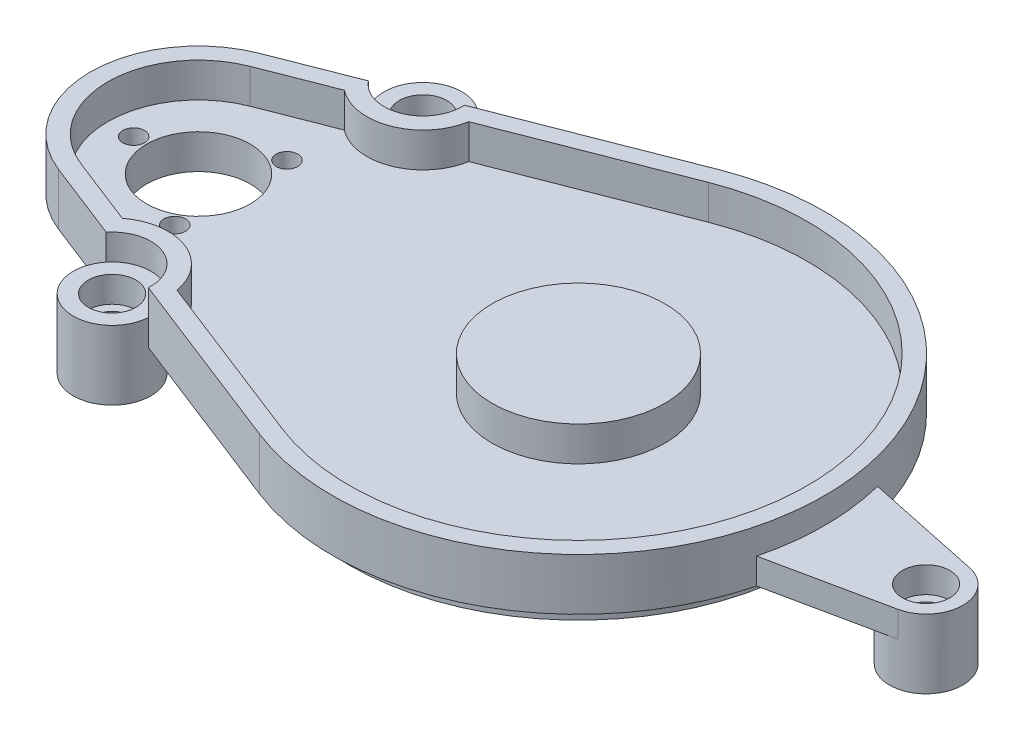
from build123d import *

# Parameters (mm, degrees)
BOSS_EXTRUDE1_DEPTH   = 6
SHELL1_T              = -2
SKETCH2_R             = 2.75
BOSS_EXTRUDE2_DEPTH   = 3
SKETCH2_R_2           = 4.5
BOSS_EXTRUDE2_2_DEPTH = 3
BOSS_EXTRUDE2_3_DEPTH = 3
BOSS_EXTRUDE3_START   = 5
SKETCH3_R             = 4.5
SKETCH3_R_2           = 4.25
BOSS_EXTRUDE3_DEPTH   = 5
SKETCH4_R             = 3.25
CUT_EXTRUDE1_DEPTH    = 2
SKETCH5_R             = 1.75
CUT_EXTRUDE2_DEPTH    = 73.907475611
BOSS_EXTRUDE5_START   = 2
SKETCH7_R             = 11
BOSS_EXTRUDE5_DEPTH   = 2
SKETCH6_R             = 1.25
SKETCH6_R_2           = 6
CUT_EXTRUDE4_DEPTH    = 73.687688091
SKETCH9_R             = 10
BOSS_EXTRUDE6_DEPTH   = 4


with BuildPart() as part:
    # Sketch1 → Boss-Extrude1 (new body)
    with BuildSketch(Plane(origin=(0, 0, 0), x_dir=(1, 0, 0), z_dir=(0, 1, 0))):
        with BuildLine():
            Line((-17.502255184, 15.174365801), (-26.545454545, 11.644262234))
            ThreePointArc((-26.545454545, 11.644262234), (-34.5, 0), (-26.545454545, -11.644262234))
            Line((-26.545454545, -11.644262234), (-17.502255184, -15.174365801))
            ThreePointArc((-17.502255184, -15.174365801), (-12.363636364, -13.808065596), (-9.50963812, -18.294364031))
            Line((-9.50963812, -18.294364031), (11.636363636, -26.548917894))
            ThreePointArc((11.636363636, -26.548917894), (50.5, 0), (11.636363636, 26.548917894))
            Line((11.636363636, 26.548917894), (-9.50963812, 18.294364031))
            ThreePointArc((-9.50963812, 18.294364031), (-12.363636364, 13.808065596), (-17.502255184, 15.174365801))
        make_face()
    extrude(amount=BOSS_EXTRUDE1_DEPTH)

    # Shell1
    shell1_openings = [part.faces().sort_by_distance(p)[0] for p in [
        (12.478104295, 6, 0),
    ]]
    offset(amount=SHELL1_T, openings=shell1_openings, kind=Kind.INTERSECTION)



with BuildPart() as body_2:
    # Sketch2 → Boss-Extrude2 (new body)
    with BuildSketch(Plane.XZ):
        with BuildLine():
            Line((49.626979567, -7), (63.125355805, -4.158876316))
            ThreePointArc((63.125355805, -4.158876316), (66.5, 0), (63.125355805, 4.158876316))
            Line((63.125355805, 4.158876316), (49.626979567, 7))
            ThreePointArc((49.626979567, 7), (50.5, 0), (49.626979567, -7))
        make_face()
        with Locations(Location((62.25, 0, 0), (0, 0, 270))):
            Circle(SKETCH2_R, mode=Mode.SUBTRACT)
    extrude(amount=-BOSS_EXTRUDE2_DEPTH)


with BuildPart() as body_3:
    # Sketch2 → Boss-Extrude2 2 (new body)
    with BuildSketch(Plane.XZ):
        with Locations(Location((-14, -18, 0), (0, 0, 270))):
            Circle(SKETCH2_R_2)
        with Locations(Location((-14, -18, 0), (0, 0, 270))):
            Circle(SKETCH2_R, mode=Mode.SUBTRACT)
    extrude(amount=-BOSS_EXTRUDE2_2_DEPTH)


with BuildPart() as body_4:
    # Sketch2 → Boss-Extrude2 3 (new body)
    with BuildSketch(Plane.XZ):
        with Locations(Location((-14, 18, 0), (0, 0, 90))):
            Circle(SKETCH2_R_2)
        with Locations(Location((-14, 18, 0), (0, 0, 90))):
            Circle(SKETCH2_R, mode=Mode.SUBTRACT)
    extrude(amount=-BOSS_EXTRUDE2_3_DEPTH)


with BuildPart() as part_1:
    add(part.part)

    add(body_2.part)  # Boss-Extrude3 merges body 2

    add(body_3.part)  # Boss-Extrude3 merges body 3

    add(body_4.part)  # Boss-Extrude3 merges body 4
    # Sketch3 → Boss-Extrude3 (add)
    with BuildSketch(Plane.XZ.offset(BOSS_EXTRUDE3_START)):
        with Locations(Location((-14, 18, 0), (0, 0, 270))):
            Circle(SKETCH3_R)
        with Locations(Location((62.25, 0, 0), (0, 0, 270))):
            Circle(SKETCH3_R_2)
        with Locations(Location((-14, -18, 0), (0, 0, 270))):
            Circle(SKETCH3_R)
    extrude(amount=-BOSS_EXTRUDE3_DEPTH)

    # Sketch4 → Cut-Extrude1 (cut)
    with BuildSketch(Plane.XZ.offset(5)):
        with Locations(Location((-14, 18, 0), (0, 0, 270))):
            Circle(SKETCH4_R)
        with Locations(Location((-14, -18, 0), (0, 0, 90))):
            Circle(SKETCH4_R)
        with Locations(Location((62.25, 0, 0), (0, 0, 270))):
            Circle(SKETCH4_R)
    extrude(amount=-CUT_EXTRUDE1_DEPTH, mode=Mode.SUBTRACT)

    # Sketch5 → Cut-Extrude2 (cut, through all)
    with BuildSketch(Plane.XZ.offset(3)):
        with Locations(Location((-14, 18, 0), (0, 0, 270))):
            Circle(SKETCH5_R)
        with Locations(Location((-14, -18, 0), (0, 0, 270))):
            Circle(SKETCH5_R)
        with Locations(Location((62.25, 0, 0), (0, 0, 270))):
            Circle(SKETCH5_R)
    extrude(amount=-CUT_EXTRUDE2_DEPTH, mode=Mode.SUBTRACT)

    # Sketch7 → Boss-Extrude5 (add)
    with BuildSketch(Plane.XZ.offset(BOSS_EXTRUDE5_START)):
        with Locations(Location((-22, 0, 0), (0, 0, 90))):
            Circle(SKETCH7_R)
        with BuildLine():
            ThreePointArc((48.5, 0), (30.585718173, 25.070609156), (1.063362758, 16.245221482))
            Line((1.063362758, 16.245221482), (1.063362758, -16.245221482))
            ThreePointArc((1.063362758, -16.245221482), (30.585718173, -25.070609156), (48.5, 0))
        make_face()
    extrude(amount=-BOSS_EXTRUDE5_DEPTH)

    # Sketch6 → Cut-Extrude4 (cut, through all)
    with BuildSketch(Plane(origin=(0, 2, 0), x_dir=(1, 0, 0), z_dir=(0, 1, 0))):
        with Locations(Location((-29.5, 0, 0), (0, 0, 270))):
            Circle(SKETCH6_R)
        with Locations(Location((-18.25, 6.495190528, 0), (0, 0, 270))):
            Circle(SKETCH6_R)
        with Locations(Location((-18.25, -6.495190528, 0), (0, 0, 270))):
            Circle(SKETCH6_R)
        with Locations(Location((-22, 0, 0), (0, 0, 270))):
            Circle(SKETCH6_R_2)
    extrude(amount=-CUT_EXTRUDE4_DEPTH, mode=Mode.SUBTRACT)

    # Sketch9 → Boss-Extrude6 (add)
    with BuildSketch(Plane(origin=(0, 2, 0), x_dir=(1, 0, 0), z_dir=(0, 1, 0))):
        with Locations(Location((22, 0, 0), (0, 0, 270))):
            Circle(SKETCH9_R)
    extrude(amount=BOSS_EXTRUDE6_DEPTH)


solid = part_1.part
